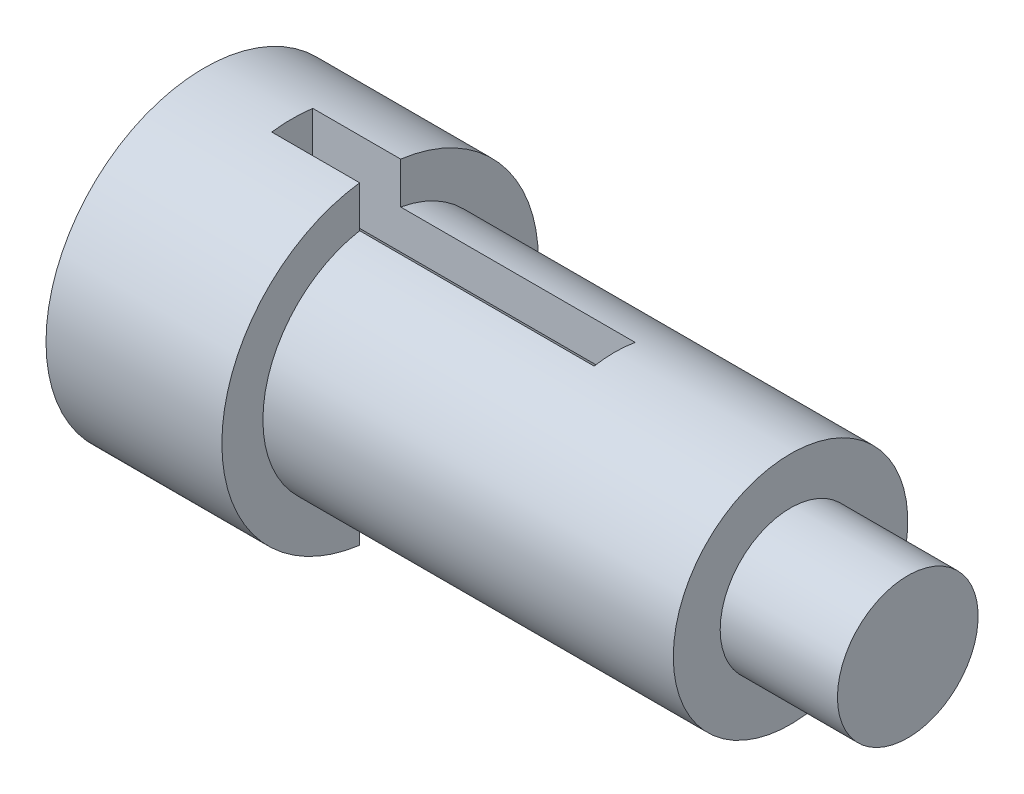
from build123d import *

# Parameters (mm, degrees)
CUT_EXTRUDE1_DEPTH      = 126.928551171
CUT_EXTRUDE1_DEPTH_BACK = 126.928551171
SKETCH2_W               = 55
SKETCH2_H               = 7


with BuildPart() as part:
    # Sketch1 → Revolve1 (revolve)
    with BuildSketch(Plane(origin=(0, 0, 0), x_dir=(1, 0, 0), z_dir=(0, 1, 0)), mode=Mode.PRIVATE) as revolve1_sk:
        Polygon((120, 0), (120, 12), (100, 12), (100, 20), (30, 20), (30, 27), (0, 27), (0, 13.5), (85, 13.5), (85, 0), align=None)
    revolve(revolve1_sk.sketch.rotate(Axis((0, 0, 0), (1, 0, 0)), 180), axis=Axis((0, 0, 0), (1, 0, 0)))

    # Sketch2 → Cut-Extrude1 (cut, two sides: drawn at the far end of the back side and taken through both)
    with BuildSketch(Plane(origin=(0, 0, 0), x_dir=(1, 0, 0), z_dir=(0, 1, 0)).offset(-CUT_EXTRUDE1_DEPTH_BACK)):
        with Locations((42.5, 0)):
            Rectangle(SKETCH2_W, SKETCH2_H)
    extrude(amount=CUT_EXTRUDE1_DEPTH + CUT_EXTRUDE1_DEPTH_BACK, mode=Mode.SUBTRACT)


solid = part.part
